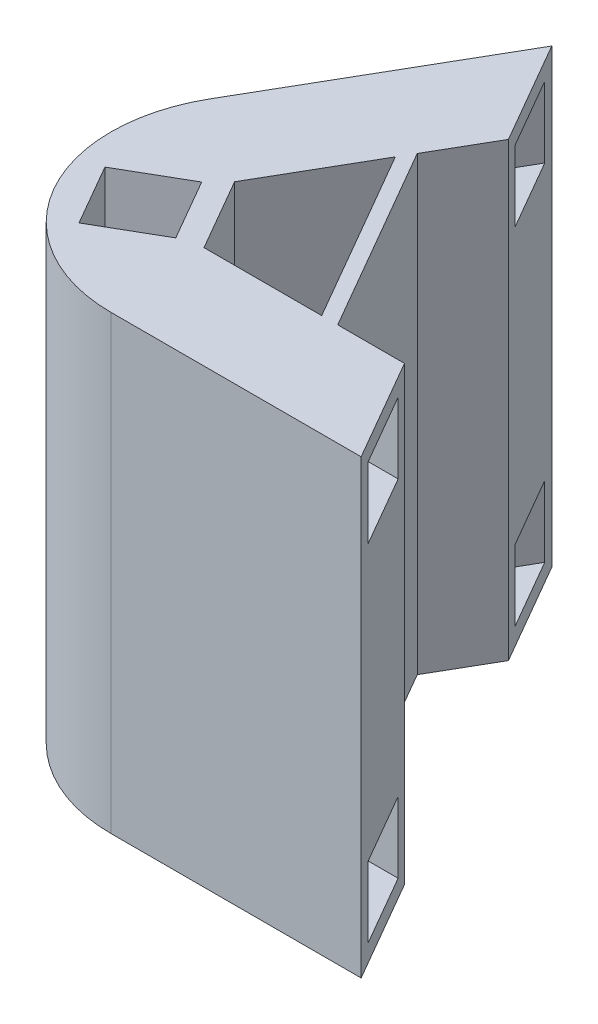
from build123d import *

# Parameters (mm, degrees)
BOSS_EXTRUDE1_DEPTH     = 130
SKETCH2_W               = 100.4
SKETCH2_H               = 20.4
CUT_EXTRUDE2_DEPTH      = 20.4
CUT_EXTRUDE3_DEPTH      = 238.223523286
FILLET1_R               = 45
CUT_EXTRUDE4_DEPTH      = 238.223523286
CUT_EXTRUDE4_DEPTH_BACK = 238.223523286
BOSS_EXTRUDE2_DEPTH     = 130


with BuildPart() as part:
    # Sketch1 → Boss-Extrude1 (new body)
    with BuildSketch(Plane(origin=(0, 0, 0), x_dir=(1, 0, 0), z_dir=(0, 1, 0))):
        Polygon((0, 0), (150, 0), (75, 129.903810568), align=None)
    extrude(amount=BOSS_EXTRUDE1_DEPTH)

    # Sketch2 → Cut-Extrude2 (cut)
    with BuildSketch(Plane(origin=(0, 5, 0), x_dir=(1, 0, 0), z_dir=(0, 1, 0))):
        Polygon((108.923840175, 138.261625339), (58.723840175, 51.312674799), (41.056921938, 61.512674799), (91.256921938, 148.461625339), align=None)
        with Locations((124, 15)):
            Rectangle(SKETCH2_W, SKETCH2_H)
    cut_extrude2 = extrude(amount=CUT_EXTRUDE2_DEPTH, mode=Mode.SUBTRACT)

    # Mirror1: Cut-Extrude2 across plane
    add(cut_extrude2.mirror(Plane.ZX.offset(65)), mode=Mode.SUBTRACT)

    # Sketch4 → Cut-Extrude3 (cut, through all)
    with BuildSketch(Plane(origin=(0, 0, 0), x_dir=(1, 0, 0), z_dir=(0, 1, 0))):
        Polygon((58.515583945, 45.561933634), (40.848665708, 35.361933634), (51.048665708, 17.695015397), (68.715583945, 27.895015397), align=None)
    extrude(amount=CUT_EXTRUDE3_DEPTH, mode=Mode.SUBTRACT)

    # Fillet1
    fillet1_edges = [part.edges().sort_by_distance(p)[0] for p in [
        (0, 65, 0),
    ]]
    fillet(fillet1_edges, radius=FILLET1_R)

    # Sketch27 → Cut-Extrude4 (cut, two sides: drawn at the far end of the back side and taken through both)
    with BuildSketch(Plane.XZ.offset(-CUT_EXTRUDE4_DEPTH_BACK)):
        Polygon((426.334426918, -29.530127019), (132.950773216, -29.530127019), (75.215746297, -29.530127019), (63.181713324, -50.373683549), (92.049226784, -100.373683549), (238.741053634, -354.45138071), (746.896447956, -647.835034411), (934.48982124, -322.913780721), align=None)
    extrude(amount=CUT_EXTRUDE4_DEPTH + CUT_EXTRUDE4_DEPTH_BACK, mode=Mode.SUBTRACT)

    # Sketch28 → Boss-Extrude2 (add)
    with BuildSketch(Plane.XZ):
        Polygon((109.106207099, -29.530127019), (80.126943725, -79.723683549), (82.436344802, -83.723683549), (113.725009252, -29.530127019), align=None)
    extrude(amount=-BOSS_EXTRUDE2_DEPTH)


solid = part.part
